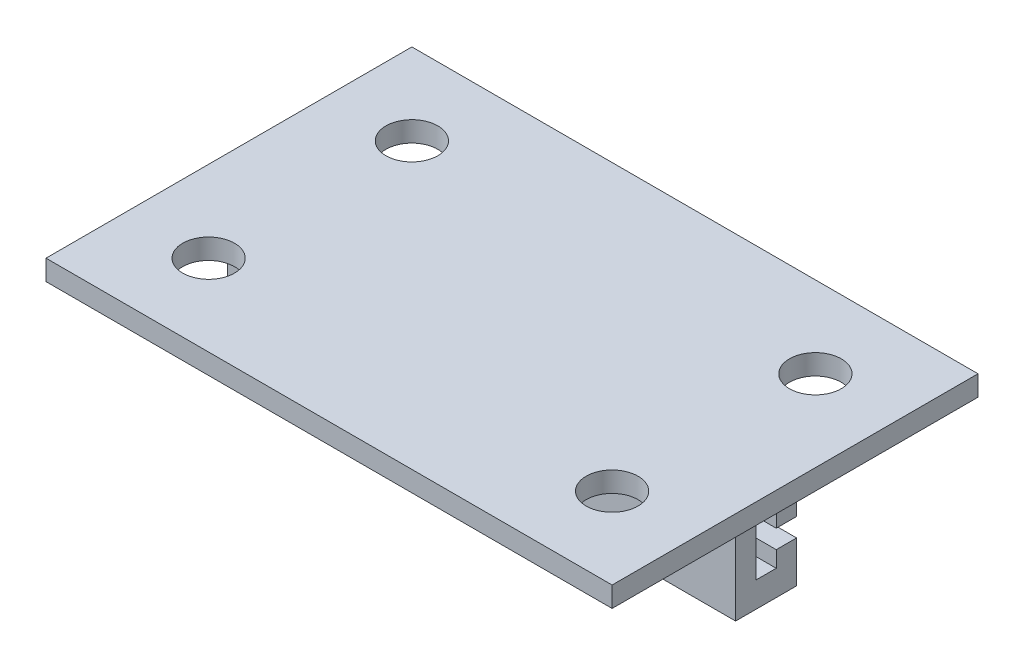
from build123d import *

# Parameters (mm, degrees)
BOSS_EXTRUDE1_DEPTH = 50
SKETCH2_W           = 55.7
SKETCH2_H           = 36
SKETCH2_R           = 2.55
BOSS_EXTRUDE2_DEPTH = 2


with BuildPart() as part:
    # Sketch1 → Boss-Extrude1 (new body)
    with BuildSketch(Plane(origin=(0, 0, 0), x_dir=(0, 0, -1), z_dir=(1, 0, 0))):
        Polygon((0, 10), (0, 0), (6, 0), (6, 4.0875), (4, 4.0875), (4, 2.5), (2, 2.5), (2, 7.5), (4, 7.5), (4, 5.9125), (6, 5.9125), (6, 10), align=None)
    extrude(amount=BOSS_EXTRUDE1_DEPTH)

    # Sketch2 → Boss-Extrude2 (add)
    with BuildSketch(Plane(origin=(0, 10, 0), x_dir=(1, 0, 0), z_dir=(0, 1, 0))):
        with Locations((25, 3)):
            Rectangle(SKETCH2_W, SKETCH2_H)
        with Locations(Location((5.15, 13, 0), (0, 0, 270))):
            Circle(SKETCH2_R, mode=Mode.SUBTRACT)
        with Locations(Location((44.85, 13, 0), (0, 0, 270))):
            Circle(SKETCH2_R, mode=Mode.SUBTRACT)
        with Locations(Location((44.85, -7, 0), (0, 0, 270))):
            Circle(SKETCH2_R, mode=Mode.SUBTRACT)
        with Locations(Location((5.15, -7, 0), (0, 0, 270))):
            Circle(SKETCH2_R, mode=Mode.SUBTRACT)
    extrude(amount=BOSS_EXTRUDE2_DEPTH)


solid = part.part
